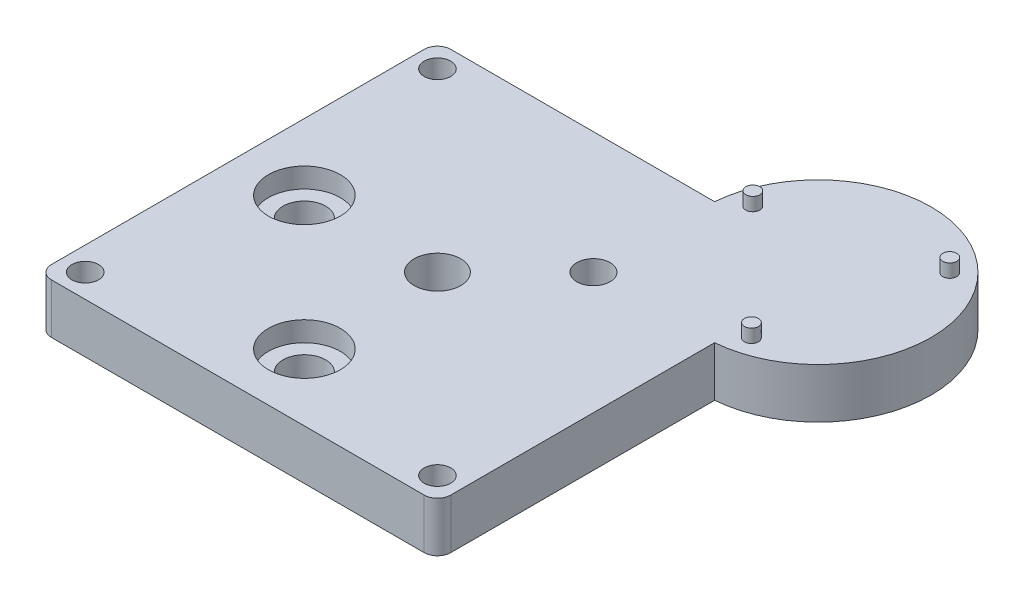
from build123d import *

# Parameters (mm, degrees)
SKETCH1_W                    = 76.2
SKETCH1_H                    = 76.2
BOSS_EXTRUDE1_DEPTH          = 9.525
SKETCH6_R                    = 3.81
CUT_EXTRUDE2_DEPTH           = 2.54
CUT_EXTRUDE2_DRAFT           = 30
CUT_EXTRUDE2_PROFILE_2_DEPTH = 2.54
CUT_EXTRUDE2_PROFILE_2_DRAFT = 30
CUT_EXTRUDE4_REACH           = 56.717
SKETCH12_R                   = 4.064
SKETCH13_R                   = 6.858
CUT_EXTRUDE7_DEPTH           = 3.81
SKETCH7_R                    = 4.445
CUT_EXTRUDE8_DEPTH           = 3.81
CUT_EXTRUDE8_TAPER           = 45
CUT_EXTRUDE9_REACH           = 56.717
SKETCH15_R                   = 4.445
FILLET1_R                    = 2.54
SKETCH17_R                   = 21.59
BOSS_EXTRUDE2_DEPTH          = 9.525
SKETCH18_R                   = 1.3335
BOSS_EXTRUDE3_DEPTH          = 2.54
CUT_EXTRUDE10_REACH          = 84.437
SKETCH20_R                   = 2.54
SKETCH20_R_2                 = 3.175


with BuildPart() as part:
    # Sketch1 → Boss-Extrude1 (new body)
    with BuildSketch(Plane(origin=(0, 0, 0), x_dir=(1, 0, 0), z_dir=(0, 1, 0))):
        Rectangle(SKETCH1_W, SKETCH1_H)
    extrude(amount=BOSS_EXTRUDE1_DEPTH)


with BuildPart() as cut_extrude2_tool:
    # Sketch6 → Cut-Extrude2 (with draft: the straight prism first)
    with BuildSketch(Plane(origin=(0, 0, 0), x_dir=(1, 0, 0), z_dir=(0, 1, 0))):
        with Locations((-27.323692655, 27.323692655)):
            Circle(SKETCH6_R)
    extrude(amount=CUT_EXTRUDE2_DEPTH)
    # Cut-Extrude2: the draft: its side faces are tilted about the plane it starts from
    cut_extrude2_sides = [cut_extrude2_tool.faces().sort_by_distance(p)[0] for p in [
        (-31.133692655, 1.27, -27.323692655),
    ]]
    draft(cut_extrude2_sides, Plane(origin=(0, 0, 0), x_dir=(1, 0, 0), z_dir=(0, 1, 0)), CUT_EXTRUDE2_DRAFT)


with BuildPart() as part_1:
    add(part.part)

    # Cut-Extrude2: cut by cut_extrude2_tool
    add(cut_extrude2_tool.part, mode=Mode.SUBTRACT)


with BuildPart() as cut_extrude2_profile_2_tool:
    # Sketch6 → Cut-Extrude2 profile 2 (with draft: the straight prism first)
    with BuildSketch(Plane(origin=(0, 0, 0), x_dir=(1, 0, 0), z_dir=(0, 1, 0))):
        with Locations((27.323692655, -27.323692655)):
            Circle(SKETCH6_R)
    extrude(amount=CUT_EXTRUDE2_PROFILE_2_DEPTH)
    # Cut-Extrude2 profile 2: the draft: its side faces are tilted about the plane it starts from
    cut_extrude2_profile_2_sides = [cut_extrude2_profile_2_tool.faces().sort_by_distance(p)[0] for p in [
        (23.513692655, 1.27, 27.323692655),
    ]]
    draft(cut_extrude2_profile_2_sides, Plane(origin=(0, 0, 0), x_dir=(1, 0, 0), z_dir=(0, 1, 0)), CUT_EXTRUDE2_PROFILE_2_DRAFT)


with BuildPart() as part_2:
    add(part_1.part)

    # Cut-Extrude2 profile 2: cut by cut_extrude2_profile_2_tool
    add(cut_extrude2_profile_2_tool.part, mode=Mode.SUBTRACT)

    # Sketch12 → Cut-Extrude4 (cut, up to next)
    with BuildSketch(Plane(origin=(0, 9.525, 0), x_dir=(1, 0, 0), z_dir=(0, 1, 0)), mode=Mode.PRIVATE) as cut_extrude4_sk1:
        with Locations(Location((-25.4, 0, 0), (0, 0, 270))):
            Circle(SKETCH12_R)
    cut_extrude4_tool1 = extrude(cut_extrude4_sk1.sketch, amount=-CUT_EXTRUDE4_REACH, mode=Mode.PRIVATE) & part_2.part
    # Sketch12 → Cut-Extrude4 (cut, up to next)
    with BuildSketch(Plane(origin=(0, 9.525, 0), x_dir=(1, 0, 0), z_dir=(0, 1, 0)), mode=Mode.PRIVATE) as cut_extrude4_sk2:
        with Locations(Location((0, -25.4, 0), (0, 0, 270))):
            Circle(SKETCH12_R)
    cut_extrude4_tool2 = extrude(cut_extrude4_sk2.sketch, amount=-CUT_EXTRUDE4_REACH, mode=Mode.PRIVATE) & part_2.part
    add(cut_extrude4_tool1.solids().sort_by_distance((-25.4, 9.525, 0))[0], mode=Mode.SUBTRACT)
    add(cut_extrude4_tool2.solids().sort_by_distance((0, 9.525, 25.4))[0], mode=Mode.SUBTRACT)

    # Sketch13 → Cut-Extrude7 (cut)
    with BuildSketch(Plane.XZ.offset(-9.525)):
        with Locations(Location((-25.4, 0, 0), (0, 0, 90))):
            Circle(SKETCH13_R)
        with Locations(Location((0, 25.4, 0), (0, 0, 90))):
            Circle(SKETCH13_R)
    extrude(amount=CUT_EXTRUDE7_DEPTH, mode=Mode.SUBTRACT)

    # Sketch7 → Cut-Extrude8 (cut)
    with BuildSketch(Plane(origin=(0, 0, 0), x_dir=(1, 0, 0), z_dir=(0, 1, 0))):
        with Locations((-27.94, -27.94)):
            Circle(SKETCH7_R)
    extrude(amount=CUT_EXTRUDE8_DEPTH, taper=CUT_EXTRUDE8_TAPER, mode=Mode.SUBTRACT)

    # Sketch15 → Cut-Extrude9 (cut, up to next)
    with BuildSketch(Plane(origin=(0, 9.525, 0), x_dir=(1, 0, 0), z_dir=(0, 1, 0)), mode=Mode.PRIVATE) as cut_extrude9_sk1:
        with Locations(Location((0, 0, 0), (0, 0, 270))):
            Circle(SKETCH15_R)
    cut_extrude9_tool1 = extrude(cut_extrude9_sk1.sketch, amount=-CUT_EXTRUDE9_REACH, mode=Mode.PRIVATE) & part_2.part
    add(cut_extrude9_tool1.solids().sort_by_distance((0, 9.525, 0))[0], mode=Mode.SUBTRACT)

    # Fillet1
    fillet1_edges = [part_2.edges().sort_by_distance(p)[0] for p in [
        (38.1, 4.7625, 38.1),
        (-38.1, 4.7625, 38.1),
        (-38.1, 4.7625, -38.1),
        (38.1, 4.7625, -38.1),
    ]]
    fillet(fillet1_edges, radius=FILLET1_R)

    # Sketch17 → Boss-Extrude2 (add)
    with BuildSketch(Plane(origin=(0, 9.525, 0), x_dir=(1, 0, 0), z_dir=(0, 1, 0))):
        with Locations((36.311274722, 36.311274722)):
            Circle(SKETCH17_R)
    extrude(amount=-BOSS_EXTRUDE2_DEPTH)

    # Sketch18 → Boss-Extrude3 (add)
    with BuildSketch(Plane(origin=(0, 9.525, 0), x_dir=(1, 0, 0), z_dir=(0, 1, 0))):
        with Locations(Location((19.166305808, 41.020673934, 0), (0, 0, 270))):
            Circle(SKETCH18_R)
        with Locations(Location((48.962218533, 48.804553742, 0), (0, 0, 270))):
            Circle(SKETCH18_R)
        with Locations(Location((40.805299824, 19.108596489, 0), (0, 0, 270))):
            Circle(SKETCH18_R)
    extrude(amount=BOSS_EXTRUDE3_DEPTH)

    # Sketch20 → Cut-Extrude10 (cut, up to next)
    with BuildSketch(Plane(origin=(0, 9.525, 0), x_dir=(1, 0, 0), z_dir=(0, 1, 0)), mode=Mode.PRIVATE) as cut_extrude10_sk1:
        with Locations(Location((-33.609871939, -33.609871939, 0), (0, 0, 270))):
            Circle(SKETCH20_R)
    cut_extrude10_tool1 = extrude(cut_extrude10_sk1.sketch, amount=-CUT_EXTRUDE10_REACH, mode=Mode.PRIVATE) & part_2.part
    # Sketch20 → Cut-Extrude10 (cut, up to next)
    with BuildSketch(Plane(origin=(0, 9.525, 0), x_dir=(1, 0, 0), z_dir=(0, 1, 0)), mode=Mode.PRIVATE) as cut_extrude10_sk2:
        with Locations(Location((33.609871939, -33.609871939, 0), (0, 0, 270))):
            Circle(SKETCH20_R)
    cut_extrude10_tool2 = extrude(cut_extrude10_sk2.sketch, amount=-CUT_EXTRUDE10_REACH, mode=Mode.PRIVATE) & part_2.part
    # Sketch20 → Cut-Extrude10 (cut, up to next)
    with BuildSketch(Plane(origin=(0, 9.525, 0), x_dir=(1, 0, 0), z_dir=(0, 1, 0)), mode=Mode.PRIVATE) as cut_extrude10_sk3:
        with Locations(Location((-33.609871939, 33.609871939, 0), (0, 0, 270))):
            Circle(SKETCH20_R)
    cut_extrude10_tool3 = extrude(cut_extrude10_sk3.sketch, amount=-CUT_EXTRUDE10_REACH, mode=Mode.PRIVATE) & part_2.part
    # Sketch20 → Cut-Extrude10 (cut, up to next)
    with BuildSketch(Plane(origin=(0, 9.525, 0), x_dir=(1, 0, 0), z_dir=(0, 1, 0)), mode=Mode.PRIVATE) as cut_extrude10_sk4:
        with Locations(Location((14.883511114, 14.883511114, 0), (0, 0, 270))):
            Circle(SKETCH20_R_2)
    cut_extrude10_tool4 = extrude(cut_extrude10_sk4.sketch, amount=-CUT_EXTRUDE10_REACH, mode=Mode.PRIVATE) & part_2.part
    add(cut_extrude10_tool1.solids().sort_by_distance((-33.609872, 9.525, 33.609872))[0], mode=Mode.SUBTRACT)
    add(cut_extrude10_tool2.solids().sort_by_distance((33.609872, 9.525, 33.609872))[0], mode=Mode.SUBTRACT)
    add(cut_extrude10_tool3.solids().sort_by_distance((-33.609872, 9.525, -33.609872))[0], mode=Mode.SUBTRACT)
    add(cut_extrude10_tool4.solids().sort_by_distance((14.883511, 9.525, -14.883511))[0], mode=Mode.SUBTRACT)


solid = part_2.part
